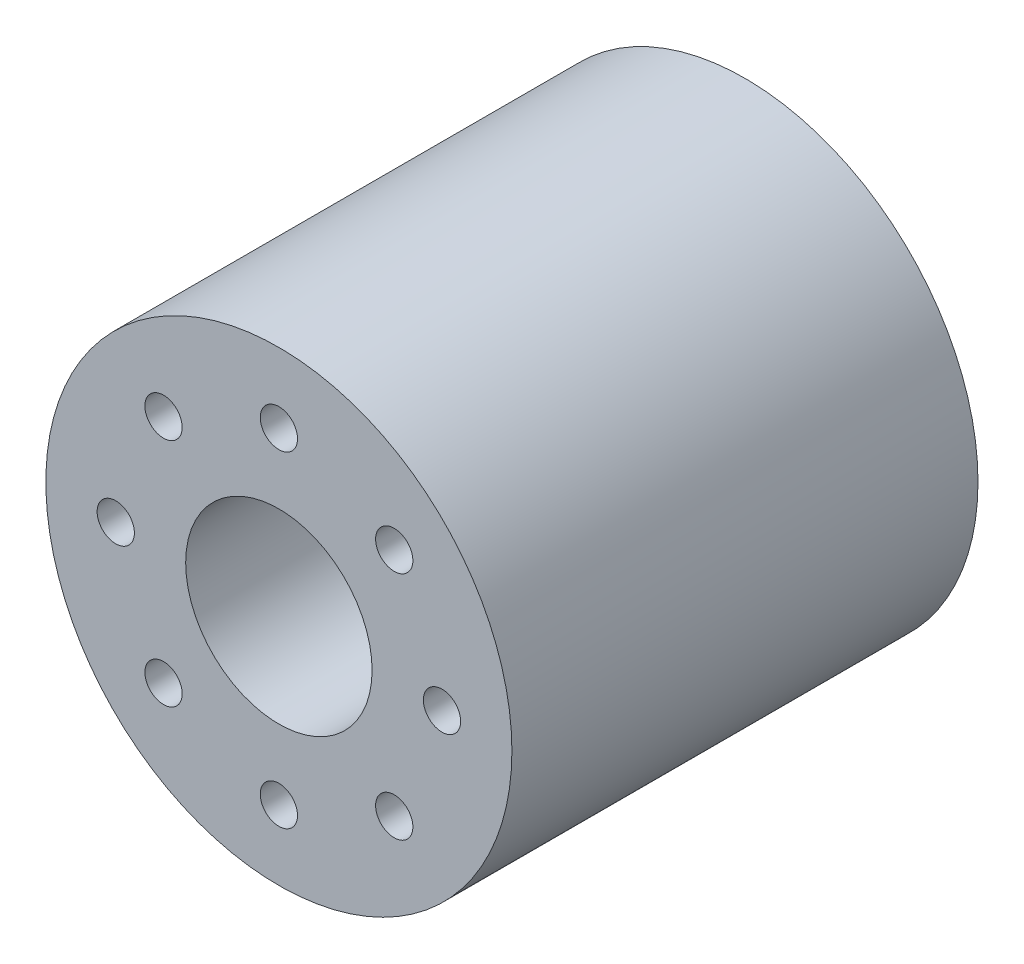
from build123d import *

# Parameters (mm, degrees)
SKIZZE1_R                       = 12.5
SKIZZE1_R_2                     = 5
AUFSATZ_LINEAR_AUSTRAGEN1_DEPTH = 25
SKIZZE2_R                       = 1
SCHNITT_LINEAR_AUSTRAGEN1_DEPTH = 25


with BuildPart() as part:
    # Skizze1 → Aufsatz-Linear austragen1 (new body)
    with BuildSketch(Plane.XY):
        Circle(SKIZZE1_R)
        Circle(SKIZZE1_R_2, mode=Mode.SUBTRACT)
    extrude(amount=AUFSATZ_LINEAR_AUSTRAGEN1_DEPTH)

    # Skizze2 → Schnitt-Linear austragen1 (cut)
    with BuildSketch(Plane.XY.offset(25)):
        with Locations((0, 8.75)):
            Circle(SKIZZE2_R)
        with Locations((6.187184335, 6.187184335)):
            Circle(SKIZZE2_R)
        with Locations((8.75, 0)):
            Circle(SKIZZE2_R)
        with Locations((6.187184335, -6.187184335)):
            Circle(SKIZZE2_R)
        with Locations((0, -8.75)):
            Circle(SKIZZE2_R)
        with Locations((-6.187184335, -6.187184335)):
            Circle(SKIZZE2_R)
        with Locations((-8.75, 0)):
            Circle(SKIZZE2_R)
        with Locations((-6.187184335, 6.187184335)):
            Circle(SKIZZE2_R)
    extrude(amount=-SCHNITT_LINEAR_AUSTRAGEN1_DEPTH, mode=Mode.SUBTRACT)


solid = part.part
